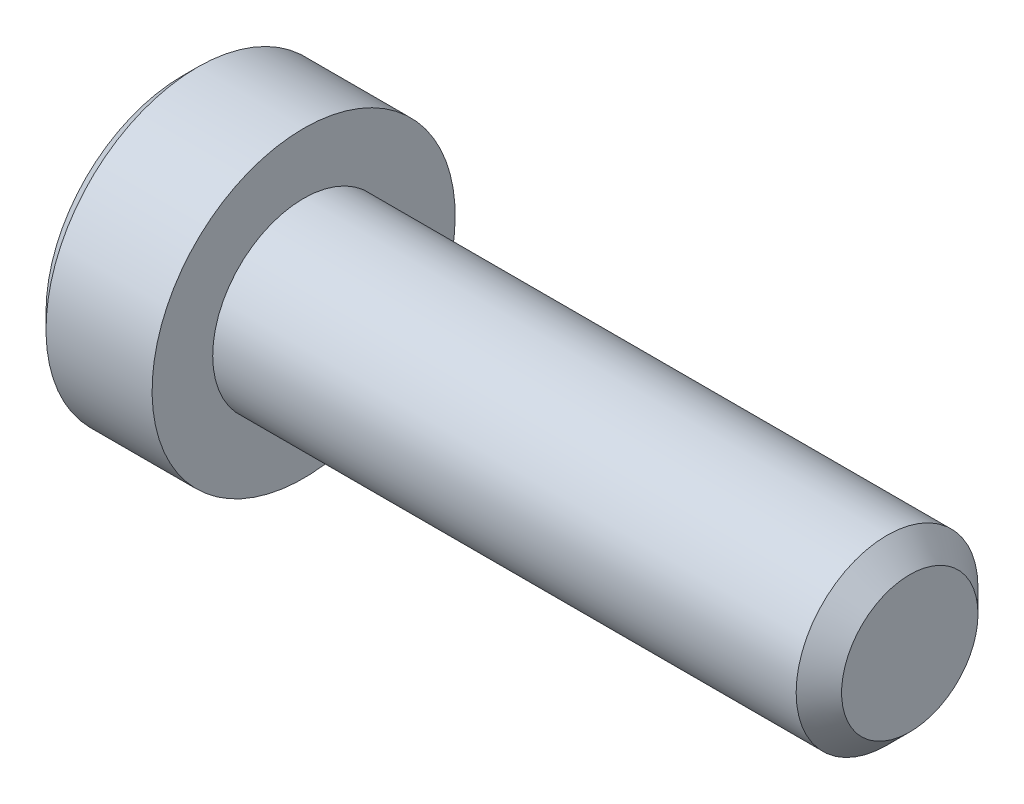
from build123d import *

# Parameters (mm, degrees)
SKETCH2_R           = 3
BOSS_EXTRUDE1_DEPTH = 20
CHAMFER1_SIZE       = 0.75
CUT_EXTRUDE1_DEPTH  = 3.12


with BuildPart() as part:
    # Sketch2 → Boss-Extrude1 (new body)
    with BuildSketch(Plane(origin=(10, 0, 0), x_dir=(0, 0, -1), z_dir=(1, 0, 0))):
        Circle(SKETCH2_R)
    extrude(amount=-BOSS_EXTRUDE1_DEPTH)

    # Chamfer1
    chamfer1_edges = [part.edges().sort_by_distance(p)[0] for p in [
        (10, 0, 3),
    ]]
    chamfer(chamfer1_edges, length=CHAMFER1_SIZE)

    # Sketch6 → Revolve1 (revolve)
    with BuildSketch(Plane.XY):
        Polygon((-13.5, 5), (-14, 4.5), (-14, 0), (-10, 0), (-10, 5), align=None)
    revolve(axis=Axis((-10, 0, 0), (-1, 0, 0)))

    # Sketch4 → Cut-Extrude1 (cut)
    with BuildSketch(Plane(origin=(-14, 0, 0), x_dir=(0, 0, -1), z_dir=(1, 0, 0))):
        Polygon((0, 2.309401077), (-2, 1.154700538), (-2, -1.154700538), (0, -2.309401077), (2, -1.154700538), (2, 1.154700538), align=None)
    extrude(amount=CUT_EXTRUDE1_DEPTH, mode=Mode.SUBTRACT)

    # Cut-Extrude2 cone 1 section (through the dimple's axis) → Cut-Extrude2 (revolve, cut)
    with BuildSketch(Plane(origin=(-14, 0, 0), x_dir=(0, 0, 1), z_dir=(0, 1, 0))):
        Polygon((0, 0), (2.309401077, 0), (0, 2.309401077), align=None)
    revolve(axis=Axis((-14, 0, 0), (1, 0, 0)), mode=Mode.SUBTRACT)


solid = part.part
